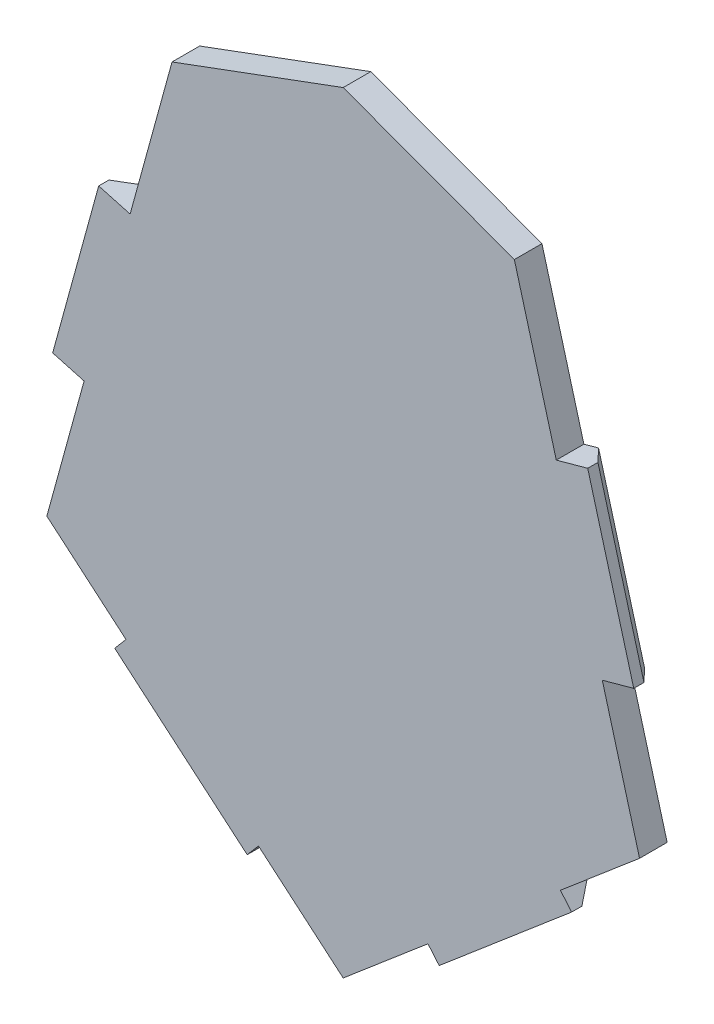
from build123d import *

# Parameters (mm, degrees)
BOSS_EXTRUDE1_DEPTH = 3.175
CHAMFER1_SIZE       = 2


with BuildPart() as part:
    # Sketch1 → Boss-Extrude1 (new body)
    with BuildSketch(Plane.XY):
        Polygon((-29.813098334, 12.635256228), (-24.517121596, 31.921329711), (-28.133260375, 32.914325349), (-33.429237113, 13.628251866), align=None)
        Polygon((0, 56.785184499), (0, -31.944815501), (-34.098545596, -2.970826443), (-19.692486788, 49.490942654), align=None)
        Polygon((0, 56.785184499), (19.692486788, 49.490942654), (34.098545596, -2.970826443), (0, -31.944815501), align=None)
        Polygon((28.133260375, 32.914325349), (24.517121596, 31.921329711), (29.813098334, 12.635256228), (33.429237113, 13.628251866), align=None)
        Polygon((-11.046183779, -25.183235467), (-9.751140598, -23.659141257), (-24.992082694, -10.708709448), (-26.287125875, -12.232803658), align=None)
        Polygon((26.287125875, -12.232803658), (11.046183779, -25.183235467), (9.751140598, -23.659141257), (24.992082694, -10.708709448), align=None)
    extrude(amount=BOSS_EXTRUDE1_DEPTH)

    # Chamfer1
    chamfer1_edges = [part.edges().sort_by_distance(p)[0] for p in [
        (18.666654827, -18.708019562, 0),
        (-18.666654827, -18.708019562, 0),
        (-30.781248744, 23.271288608, 0),
        (30.781248744, 23.271288608, 0),
    ]]
    chamfer(chamfer1_edges, length=CHAMFER1_SIZE)


solid = part.part
